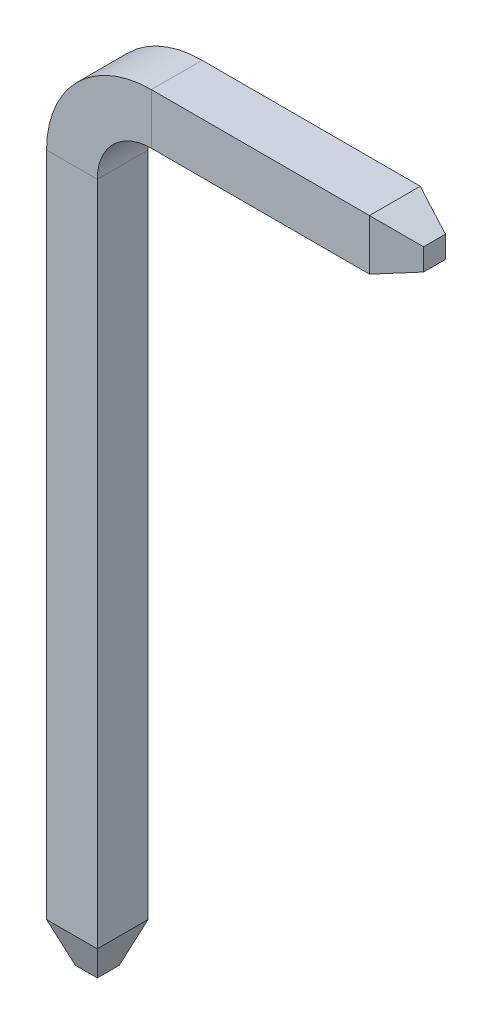
from build123d import *
from OCP.BRepFilletAPI import BRepFilletAPI_MakeChamfer

# Parameters (mm, degrees)
SKETCH_1_W      = 0.64
SKETCH_1_H      = 0.64
CHAMFER_1_SIZE  = 0.5
CHAMFER_1_SIZE2 = 0.181985117
CHAMFER_2_SIZE  = 0.5
CHAMFER_2_SIZE2 = 0.181985117


with BuildPart() as part:
    # По траектории1: sweep along a path in Эскиз2
    with BuildLine(Plane.XY) as sweep_1_path:
        Line((4.25, 2.65), (1, 2.65))
        ThreePointArc((1, 2.65), (0.292893219, 2.357106781), (0, 1.65))
        Line((0, 1.65), (0, 0))
        Line((0, 0), (0, -7.25))
    # Эскиз1 → По траектории1 (sweep)
    with BuildSketch(Plane(origin=(0, 0, 0), x_dir=(1, 0, 0), z_dir=(0, 1, 0))):
        Rectangle(SKETCH_1_W, SKETCH_1_H)
    sweep(path=sweep_1_path.line)

    # Фаска1: one chamfer whose edges measure the first distance from different faces: ONE call of the kernel's chamfer builder (chamfer() names one face for all edges)
    chamfer_1_edges_1 = [part.edges().sort_by_distance(p)[0] for p in [
        (4.25, 2.97, 0),
    ]]
    chamfer_1_side_1 = [part.faces().sort_by_distance(p)[0] for p in [
        (2.625, 2.97, 0),
    ]]
    chamfer_1_edges_2 = [part.edges().sort_by_distance(p)[0] for p in [
        (4.25, 2.65, 0.32),
    ]]
    chamfer_1_side_2 = [part.faces().sort_by_distance(p)[0] for p in [
        (2.625, 2.858047644, 0.32),
    ]]
    chamfer_1_edges_3 = [part.edges().sort_by_distance(p)[0] for p in [
        (4.25, 2.33, 0),
    ]]
    chamfer_1_side_3 = [part.faces().sort_by_distance(p)[0] for p in [
        (2.625, 2.33, 0),
    ]]
    chamfer_1_edges_4 = [part.edges().sort_by_distance(p)[0] for p in [
        (4.25, 2.65, -0.32),
    ]]
    chamfer_1_side_4 = [part.faces().sort_by_distance(p)[0] for p in [
        (2.625, 2.441952356, -0.32),
    ]]
    chamfer_1 = BRepFilletAPI_MakeChamfer(part.part.solid().wrapped)
    for e in chamfer_1_edges_1:
        chamfer_1.Add(CHAMFER_1_SIZE, CHAMFER_1_SIZE2, e.wrapped, chamfer_1_side_1[0].wrapped)  # the first distance lies on this face
    for e in chamfer_1_edges_2:
        chamfer_1.Add(CHAMFER_1_SIZE, CHAMFER_1_SIZE2, e.wrapped, chamfer_1_side_2[0].wrapped)  # the first distance lies on this face
    for e in chamfer_1_edges_3:
        chamfer_1.Add(CHAMFER_1_SIZE, CHAMFER_1_SIZE2, e.wrapped, chamfer_1_side_3[0].wrapped)  # the first distance lies on this face
    for e in chamfer_1_edges_4:
        chamfer_1.Add(CHAMFER_1_SIZE, CHAMFER_1_SIZE2, e.wrapped, chamfer_1_side_4[0].wrapped)  # the first distance lies on this face
    add(Compound.cast(chamfer_1.Shape()), mode=Mode.REPLACE)

    # Фаска2: one chamfer whose edges measure the first distance from different faces: ONE call of the kernel's chamfer builder (chamfer() names one face for all edges)
    chamfer_2_edges_1 = [part.edges().sort_by_distance(p)[0] for p in [
        (0, -7.25, 0.32),
    ]]
    chamfer_2_side_1 = [part.faces().sort_by_distance(p)[0] for p in [
        (2.375, 2.859993955, 0.32),
    ]]
    chamfer_2_edges_2 = [part.edges().sort_by_distance(p)[0] for p in [
        (0.32, -7.25, 0),
    ]]
    chamfer_2_side_2 = [part.faces().sort_by_distance(p)[0] for p in [
        (0.32, -2.8, 0),
    ]]
    chamfer_2_edges_3 = [part.edges().sort_by_distance(p)[0] for p in [
        (0, -7.25, -0.32),
    ]]
    chamfer_2_side_3 = [part.faces().sort_by_distance(p)[0] for p in [
        (2.375, 2.440006045, -0.32),
    ]]
    chamfer_2_edges_4 = [part.edges().sort_by_distance(p)[0] for p in [
        (-0.32, -7.25, 0),
    ]]
    chamfer_2_side_4 = [part.faces().sort_by_distance(p)[0] for p in [
        (-0.32, -2.8, 0),
    ]]
    chamfer_2 = BRepFilletAPI_MakeChamfer(part.part.solid().wrapped)
    for e in chamfer_2_edges_1:
        chamfer_2.Add(CHAMFER_2_SIZE, CHAMFER_2_SIZE2, e.wrapped, chamfer_2_side_1[0].wrapped)  # the first distance lies on this face
    for e in chamfer_2_edges_2:
        chamfer_2.Add(CHAMFER_2_SIZE, CHAMFER_2_SIZE2, e.wrapped, chamfer_2_side_2[0].wrapped)  # the first distance lies on this face
    for e in chamfer_2_edges_3:
        chamfer_2.Add(CHAMFER_2_SIZE, CHAMFER_2_SIZE2, e.wrapped, chamfer_2_side_3[0].wrapped)  # the first distance lies on this face
    for e in chamfer_2_edges_4:
        chamfer_2.Add(CHAMFER_2_SIZE, CHAMFER_2_SIZE2, e.wrapped, chamfer_2_side_4[0].wrapped)  # the first distance lies on this face
    add(Compound.cast(chamfer_2.Shape()), mode=Mode.REPLACE)


solid = part.part
